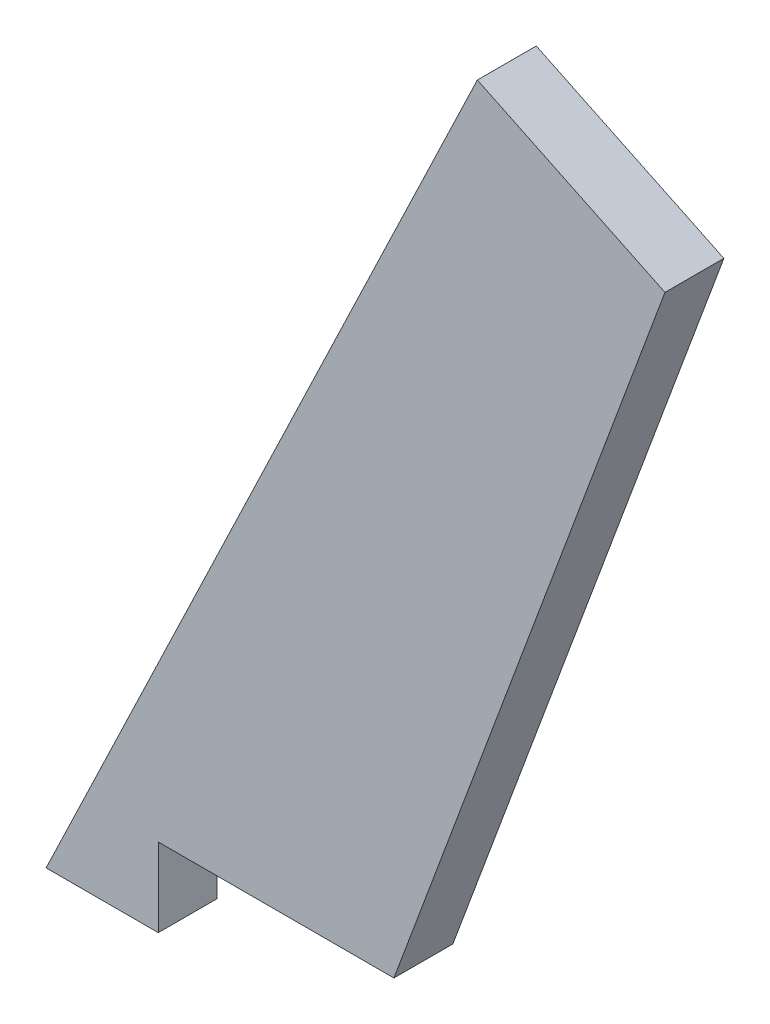
from build123d import *

# Parameters (mm, degrees)
BOSS_EXTRUDE1_DEPTH = 9.525


with BuildPart() as part:
    # Sketch1 → Boss-Extrude1 (new body)
    with BuildSketch(Plane.XY):
        Polygon((18.140896204, 0), (18.140896204, 12.7), (56.240896204, 12.7), (100.070510437, 130.627406127), (69.732857156, 145.197437644), (0, 0), align=None)
    extrude(amount=BOSS_EXTRUDE1_DEPTH)


solid = part.part
